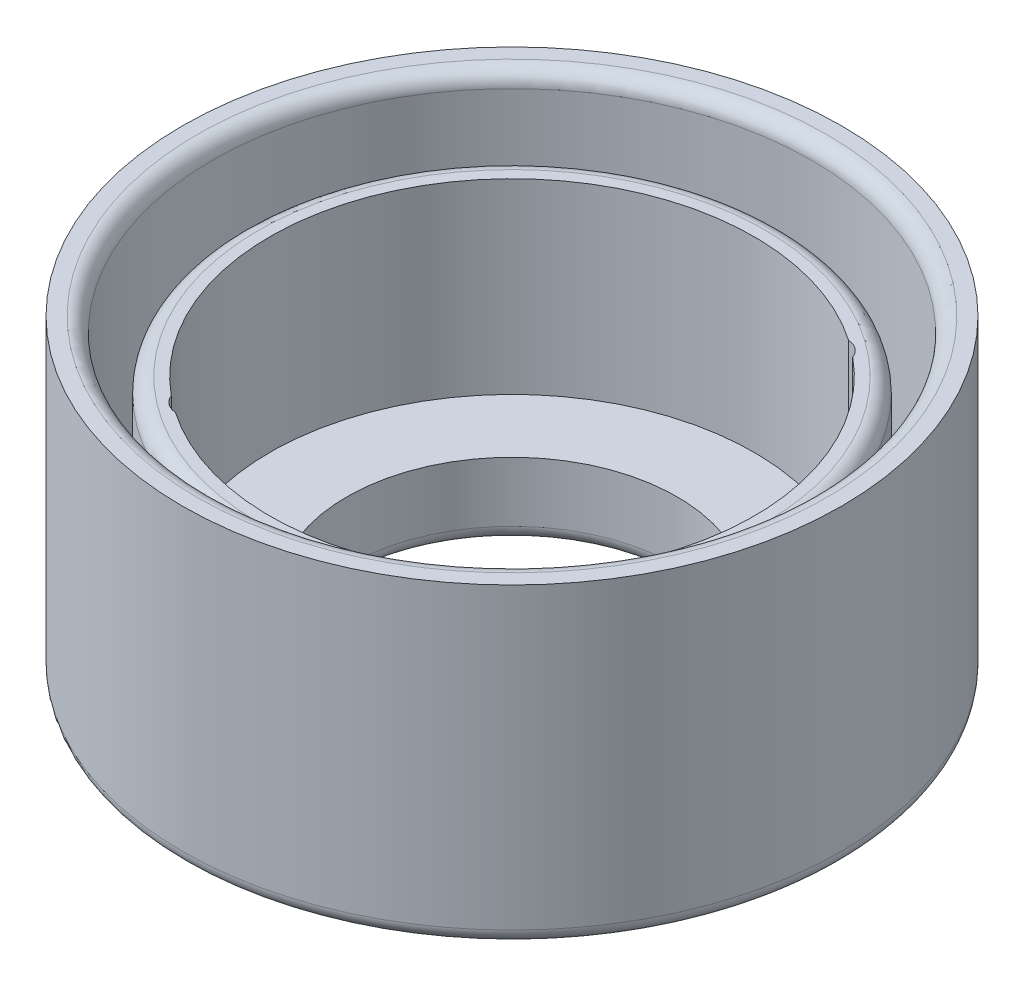
from build123d import *

# Parameters (mm, degrees)
CROQUIS1_R              = 22.05
CROQUIS1_R_2            = 20.05
SALIENTE_EXTRUIR1_DEPTH = 16
CROQUIS1_4_R            = 17.95
CROQUIS1_4_R_2          = 16.2
SALIENTE_EXTRUIR2_DEPTH = 12.5
SALIENTE_EXTRUIR4_START = -5
CROQUIS1_6_R            = 22.05
SALIENTE_EXTRUIR4_DEPTH = 5
CORTAR_EXTRUIR1_REACH   = 39.595
CROQUIS4_R              = 11.05
CROQUIS4_R_2            = 1.25
CROQUIS5_R              = 2.5
CROQUIS5_R_2            = 1.25
CORTAR_EXTRUIR2_DEPTH   = 3
REDONDEO1_R             = 1
REDONDEO2_R             = 1
REDONDEO3_R             = 1


with BuildPart() as part:
    # Croquis1 → Saliente-Extruir1 (new body)
    with BuildSketch(Plane(origin=(0, 0, 0), x_dir=(1, 0, 0), z_dir=(0, 1, 0))):
        Circle(CROQUIS1_R)
        Circle(CROQUIS1_R_2, mode=Mode.SUBTRACT)
    extrude(amount=SALIENTE_EXTRUIR1_DEPTH)



with BuildPart() as body_2:
    # Croquis1<4> → Saliente-Extruir2 (new body)
    with BuildSketch(Plane(origin=(0, 0, 0), x_dir=(1, 0, 0), z_dir=(0, 1, 0))):
        Circle(CROQUIS1_4_R)
        Circle(CROQUIS1_4_R_2, mode=Mode.SUBTRACT)
    extrude(amount=SALIENTE_EXTRUIR2_DEPTH)


with BuildPart() as part_1:
    add(part.part)

    add(body_2.part)  # Saliente-Extruir4 merges body 2
    # Croquis1<6> → Saliente-Extruir4 (add)
    with BuildSketch(Plane(origin=(0, 0, 0), x_dir=(1, 0, 0), z_dir=(0, 1, 0)).offset(SALIENTE_EXTRUIR4_START)):
        Circle(CROQUIS1_6_R)
    extrude(amount=SALIENTE_EXTRUIR4_DEPTH)

    # Croquis4 → Cortar-Extruir1 (cut, up to next)
    with BuildSketch(Plane.XZ.offset(5), mode=Mode.PRIVATE) as cortar_extruir1_sk1:
        Circle(CROQUIS4_R)
    cortar_extruir1_tool1 = extrude(cortar_extruir1_sk1.sketch, amount=-CORTAR_EXTRUIR1_REACH, mode=Mode.PRIVATE) & part_1.part
    # Croquis4 → Cortar-Extruir1 (cut, up to next)
    with BuildSketch(Plane.XZ.offset(5), mode=Mode.PRIVATE) as cortar_extruir1_sk2:
        with Locations((-9.1, 12.1)):
            Circle(CROQUIS4_R_2)
    cortar_extruir1_tool2 = extrude(cortar_extruir1_sk2.sketch, amount=-CORTAR_EXTRUIR1_REACH, mode=Mode.PRIVATE) & part_1.part
    # Croquis4 → Cortar-Extruir1 (cut, up to next)
    with BuildSketch(Plane.XZ.offset(5), mode=Mode.PRIVATE) as cortar_extruir1_sk3:
        with Locations((9.1, -12.1)):
            Circle(CROQUIS4_R_2)
    cortar_extruir1_tool3 = extrude(cortar_extruir1_sk3.sketch, amount=-CORTAR_EXTRUIR1_REACH, mode=Mode.PRIVATE) & part_1.part
    add(cortar_extruir1_tool1.solids().sort_by_distance((0, -5, 0))[0], mode=Mode.SUBTRACT)
    add(cortar_extruir1_tool2.solids().sort_by_distance((-9.1, -5, 12.1))[0], mode=Mode.SUBTRACT)
    add(cortar_extruir1_tool3.solids().sort_by_distance((9.1, -5, -12.1))[0], mode=Mode.SUBTRACT)

    # Croquis5 → Cortar-Extruir2 (cut)
    # profile 1 of 2: a face of its own
    with BuildSketch(Plane.XZ.offset(5)):
        with Locations((-9.1, 12.1)):
            Circle(CROQUIS5_R)
        with Locations((-9.1, 12.1)):
            Circle(CROQUIS5_R_2, mode=Mode.SUBTRACT)
    # profile 2 of 2: a face of its own
    with BuildSketch(Plane.XZ.offset(5)):
        with Locations((9.1, -12.1)):
            Circle(CROQUIS5_R)
        with Locations((9.1, -12.1)):
            Circle(CROQUIS5_R_2, mode=Mode.SUBTRACT)
    extrude(amount=-CORTAR_EXTRUIR2_DEPTH, mode=Mode.SUBTRACT)

    # Redondeo1
    redondeo1_edges = [part_1.edges().sort_by_distance(p)[0] for p in [
        (-11.05, -5, 0),
    ]]
    fillet(redondeo1_edges, radius=REDONDEO1_R)

    # Redondeo2
    redondeo2_edges = [part_1.edges().sort_by_distance(p)[0] for p in [
        (-17.95, 12.5, 0),
        (-20.05, 16, 0),
    ]]
    fillet(redondeo2_edges, radius=REDONDEO2_R)

    # Redondeo3
    redondeo3_edges = [part_1.edges().sort_by_distance(p)[0] for p in [
        (-22.05, -5, 0),
    ]]
    fillet(redondeo3_edges, radius=REDONDEO3_R)


solid = part_1.part
